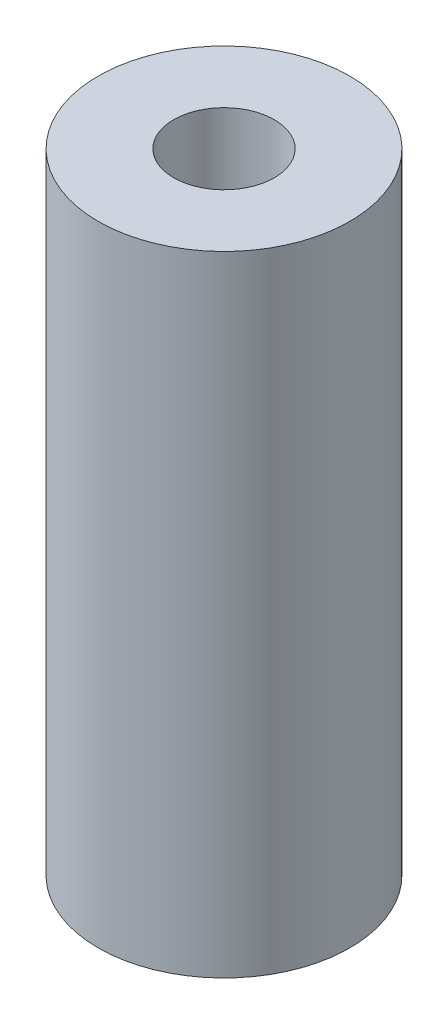
from build123d import *

# Parameters (mm, degrees)
SKETCH_1_R      = 4
SKETCH_1_R_2    = 1.6
EXTRUDE_1_DEPTH = 20


with BuildPart() as part:
    # 草图1 → 凸台-拉伸1 (new body)
    with BuildSketch(Plane(origin=(0, 0, 0), x_dir=(1, 0, 0), z_dir=(0, 1, 0))):
        with Locations(Location((0, 0, 0), (0, 0, 270))):
            Circle(SKETCH_1_R)
        with Locations(Location((0, 0, 0), (0, 0, 270))):
            Circle(SKETCH_1_R_2, mode=Mode.SUBTRACT)
    extrude(amount=EXTRUDE_1_DEPTH)


solid = part.part
